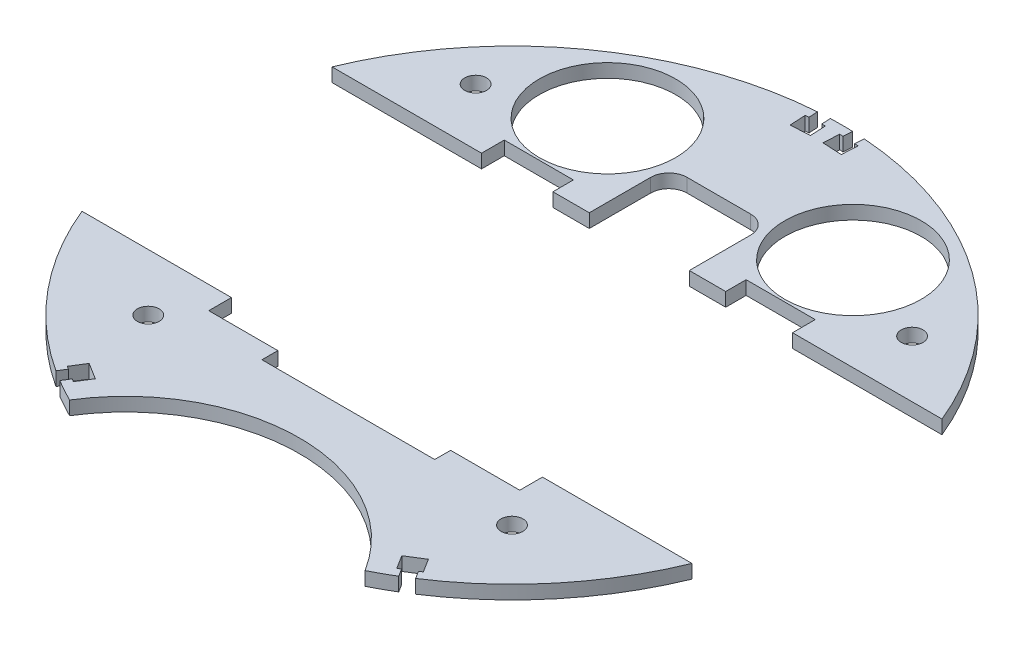
from build123d import *

# Parameters (mm, degrees)
BOSS_EXTRUDE1_DEPTH  = 3
SOLENOID_PLACEMENT_W = 38
SOLENOID_PLACEMENT_H = 64
CUT_EXTRUDE1_DEPTH   = 103.574363269
SKETCH3_R            = 12
CUT_EXTRUDE3_DEPTH   = 103.574363269
SKETCH4_R            = 2.4
CUT_EXTRUDE4_DEPTH   = 103.574363269
CUT_EXTRUDE2_DEPTH   = 103.574363269
CUT_EXTRUDE5_DEPTH   = 99.819279495
SKETCH6_R            = 15
CUT_EXTRUDE10_DEPTH  = 99.819279495
CUT_EXTRUDE11_DEPTH  = 99.819279495


with BuildPart() as part:
    # Sketch1 → Boss-Extrude1 (new body)
    with BuildSketch(Plane(origin=(0, 0, 0), x_dir=(1, 0, 0), z_dir=(0, 1, 0))):
        with BuildLine():
            ThreePointArc((32.48910875, -64.812867647), (0, 72.5), (-32.48910875, -64.812867647))
            ThreePointArc((-32.48910875, -64.812867647), (0, -46.75), (32.48910875, -64.812867647))
        make_face()
    extrude(amount=BOSS_EXTRUDE1_DEPTH)

    # solenoid placement → Cut-Extrude1 (cut, through all)
    with BuildSketch(Plane(origin=(0, 3, 0), x_dir=(1, 0, 0), z_dir=(0, 1, 0))):
        with Locations((0, -4)):
            Rectangle(SOLENOID_PLACEMENT_W, SOLENOID_PLACEMENT_H)
    extrude(amount=-CUT_EXTRUDE1_DEPTH, mode=Mode.SUBTRACT)

    # Sketch3 → Cut-Extrude3 (cut, through all)
    with BuildSketch(Plane(origin=(0, 3, 0), x_dir=(1, 0, 0), z_dir=(0, 1, 0))):
        with Locations(Location((27, 48, 0), (0, 0, 270))):
            Circle(SKETCH3_R)
        with Locations(Location((-27, 48, 0), (0, 0, 270))):
            Circle(SKETCH3_R)
    extrude(amount=-CUT_EXTRUDE3_DEPTH, mode=Mode.SUBTRACT)

    # Sketch4 → Cut-Extrude4 (cut, through all)
    with BuildSketch(Plane(origin=(0, 3, 0), x_dir=(1, 0, 0), z_dir=(0, 1, 0))):
        with Locations(Location((40, -40, 0), (0, 0, 270))):
            Circle(SKETCH4_R)
        with Locations(Location((-40, -40, 0), (0, 0, 270))):
            Circle(SKETCH4_R)
        with Locations(Location((48, 40, 0), (0, 0, 270))):
            Circle(SKETCH4_R)
        with Locations(Location((-48, 40, 0), (0, 0, 270))):
            Circle(SKETCH4_R)
    extrude(amount=-CUT_EXTRUDE4_DEPTH, mode=Mode.SUBTRACT)

    # Sketch2 → Cut-Extrude2 (cut, through all)
    with BuildSketch(Plane(origin=(0, 3, 0), x_dir=(1, 0, 0), z_dir=(0, 1, 0))):
        with BuildLine():
            Line((34.2, -27.5), (34.2, -32.5))
            Line((34.2, -32.5), (22.2, -32.5))
            Line((22.2, -32.5), (19, -32.5))
            Line((19, -32.5), (19, 32.5))
            Line((19, 32.5), (22.2, 32.5))
            Line((22.2, 32.5), (34.2, 32.5))
            Line((34.2, 32.5), (34.2, 27.5))
            Line((34.2, 27.5), (67.082039325, 27.5))
            ThreePointArc((67.082039325, 27.5), (72.5, 0), (67.082039325, -27.5))
            Line((67.082039325, -27.5), (34.2, -27.5))
        make_face()
        with BuildLine():
            Line((-34.2, -32.5), (-22.2, -32.5))
            Line((-22.2, -32.5), (-19, -32.5))
            Line((-19, -32.5), (-19, 32.5))
            Line((-19, 32.5), (-22.2, 32.5))
            Line((-22.2, 32.5), (-34.2, 32.5))
            Line((-34.2, 32.5), (-34.2, 27.5))
            Line((-34.2, 27.5), (-67.082039325, 27.5))
            ThreePointArc((-67.082039325, 27.5), (-72.5, 0), (-67.082039325, -27.5))
            Line((-67.082039325, -27.5), (-34.2, -27.5))
            Line((-34.2, -27.5), (-34.2, -32.5))
        make_face()
    extrude(amount=-CUT_EXTRUDE2_DEPTH, mode=Mode.SUBTRACT)


with BuildPart() as cut_extrude2_piece_1:
    # of the separate pieces the step leaves, piece 1, a body of its own (cut_extrude2_pieces)
    add(part.part.solids().sort_by_distance((67.082039325, 0, -27.5))[0])

    # Sketch5 → Cut-Extrude5 (cut, through all)
    with BuildSketch(Plane(origin=(0, 3, 0), x_dir=(1, 0, 0), z_dir=(0, 1, 0))):
        with BuildLine():
            Line((-11, 41.5), (-11, 28))
            Line((-11, 28), (11, 28))
            Line((11, 28), (11, 41.5))
            ThreePointArc((11, 41.5), (9.828427125, 44.328427125), (7, 45.5))
            Line((7, 45.5), (-7, 45.5))
            ThreePointArc((-7, 45.5), (-9.828427125, 44.328427125), (-11, 41.5))
        make_face()
    extrude(amount=-CUT_EXTRUDE5_DEPTH, mode=Mode.SUBTRACT)

    # Sketch6 → Cut-Extrude10 (cut, through all)
    with BuildSketch(Plane(origin=(0, 3, 0), x_dir=(-1, 0, 0), z_dir=(0, 1, 0))):
        with Locations(Location((-27, -48, 0), (0, 0, 90))):
            Circle(SKETCH6_R)
        with Locations(Location((27, -48, 0), (0, 0, 90))):
            Circle(SKETCH6_R)
    extrude(amount=-CUT_EXTRUDE10_DEPTH, mode=Mode.SUBTRACT)


with BuildPart() as cut_extrude2_piece_2:
    # of the separate pieces the step leaves, piece 2, a body of its own (cut_extrude2_pieces)
    add(part.part.solids().sort_by_distance((32.48910875, 0, 64.812867647))[0])


with BuildPart() as cut_extrude11_tool:
    # Sketch7 → Cut-Extrude11 (new, through all)
    with BuildSketch(Plane(origin=(0, 3, 0), x_dir=(1, 0, 0), z_dir=(0, 1, 0))):
        Polygon((-5.037834787, 70.332728659), (-5.811772676, 70.292168293), (-5.62859683, 66.796964922), (-1.384421307, 67.019392736), (-1.567597154, 70.514596107), (-2.341535043, 70.474035741), (-2.446206956, 72.471294811), (-5.1425067, 72.329987729), align=None)
        Polygon((5.811772676, 70.292168293), (5.037834787, 70.332728659), (5.1425067, 72.329987729), (2.446206956, 72.471294811), (2.341535043, 70.474035741), (1.567597154, 70.514596107), (1.384421307, 67.019392736), (5.62859683, 66.796964922), align=None)
        Polygon((38.504173058, -59.071999772), (39.161410333, -58.661312343), (37.306692908, -55.693144006), (33.702488499, -57.945300879), (35.557205924, -60.913469216), (36.214443199, -60.502781786), (37.274281727, -62.198877978), (39.564011587, -60.768095965), align=None)
        Polygon((-39.161410333, -58.661312343), (-38.504173058, -59.071999772), (-39.564011587, -60.768095965), (-37.274281727, -62.198877978), (-36.214443199, -60.502781786), (-35.557205924, -60.913469216), (-33.702488499, -57.945300879), (-37.306692908, -55.693144006), align=None)
    extrude(amount=-CUT_EXTRUDE11_DEPTH)


with BuildPart() as cut_extrude2_piece_1_1:
    add(cut_extrude2_piece_1.part)

    # Cut-Extrude11: cut by cut_extrude11_tool
    add(cut_extrude11_tool.part, mode=Mode.SUBTRACT)


with BuildPart() as cut_extrude2_piece_2_1:
    add(cut_extrude2_piece_2.part)

    # Cut-Extrude11: cut by cut_extrude11_tool
    add(cut_extrude11_tool.part, mode=Mode.SUBTRACT)


solid = Compound([cut_extrude2_piece_1_1.part, cut_extrude2_piece_2_1.part])
